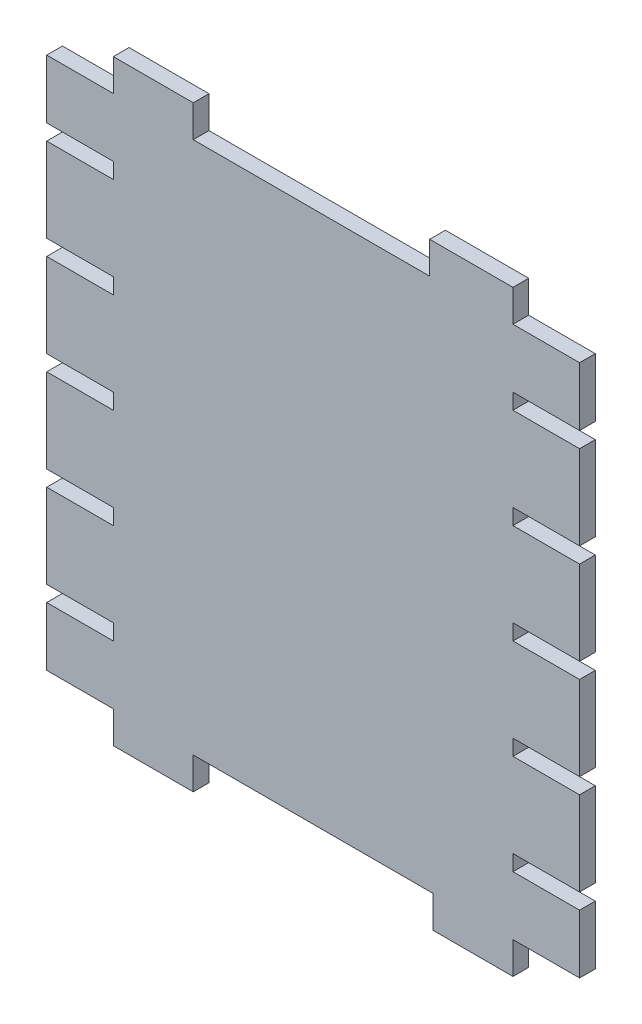
from build123d import *

# Parameters (mm, degrees)
BOSS_EXTRUDE1_DEPTH = 2.9972


with BuildPart() as part:
    # Sketch1 → Boss-Extrude1 (new body)
    with BuildSketch(Plane.XY):
        Polygon((-50.8, -73.399790699), (-50.8, -89.452590699), (-38.1, -89.452590699), (-38.1, -92.449790699), (-50.8, -92.449790699), (-50.8, -108.502590699), (-38.1, -108.502590699), (-38.1, -111.499790699), (-50.8, -111.499790699), (-50.8, -127.552590699), (-38.1, -127.552590699), (-38.1, -130.549790699), (-50.8, -130.549790699), (-50.8, -141.751190699), (-38.1, -141.751190699), (-38.1, -147.847190699), (-22.86, -147.847190699), (-22.86, -141.751190699), (22.86, -141.751190699), (22.86, -147.847190699), (38.1, -147.847190699), (38.1, -141.751190699), (50.8, -141.751190699), (50.8, -130.549790699), (38.1, -130.549790699), (38.1, -127.552590699), (50.8, -127.552590699), (50.8, -111.499790699), (38.1, -111.499790699), (38.1, -108.502590699), (50.8, -108.502590699), (50.8, -92.449790699), (38.1, -92.449790699), (38.1, -89.452590699), (50.8, -89.452590699), (50.8, -73.399790699), (38.1, -73.399790699), (38.1, -70.402590699), (50.8, -70.402590699), (50.8, -54.349790699), (38.1, -54.349790699), (38.1, -51.352590699), (50.8, -51.352590699), (50.8, -40.151190699), (38.1, -40.151190699), (38.1, -34.055190699), (22.225, -34.055190699), (22.225, -40.151190699), (-22.86, -40.151190699), (-22.86, -34.055190699), (-38.1, -34.055190699), (-38.1, -40.151190699), (-50.8, -40.151190699), (-50.8, -51.352590699), (-38.1, -51.352590699), (-38.1, -54.349790699), (-50.8, -54.349790699), (-50.8, -70.402590699), (-38.1, -70.402590699), (-38.1, -73.399790699), align=None)
    extrude(amount=BOSS_EXTRUDE1_DEPTH)


solid = part.part
